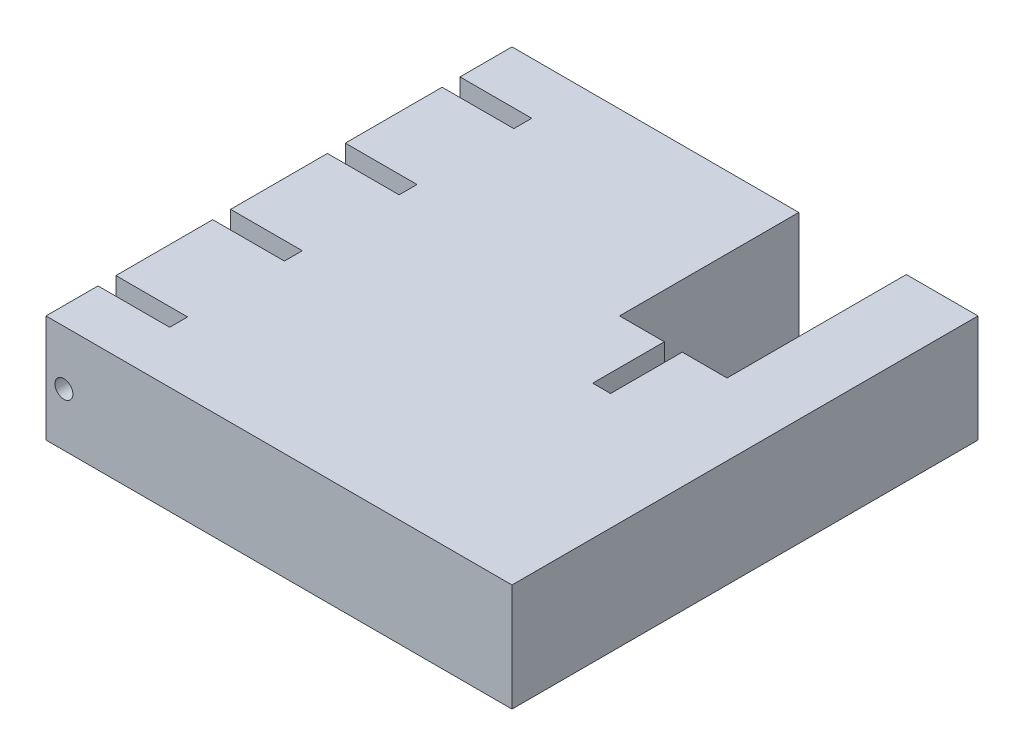
from build123d import *

# Parameters (mm, degrees)
SKETCH2_W               = 130
SKETCH2_H               = 130
BOSS_EXTRUDE1_DEPTH     = 30
CUT_EXTRUDE1_DEPTH      = 163.102342109
CUT_EXTRUDE1_DEPTH_BACK = 163.102342109
SKETCH3_W               = 20
SKETCH3_H               = 5
CUT_EXTRUDE2_DEPTH      = 163.102342109
CUT_EXTRUDE2_DEPTH_BACK = 163.102342109
SKETCH8_W               = 20
SKETCH8_H               = 5
CUT_EXTRUDE3_DEPTH      = 176.12028954
CUT_EXTRUDE3_DEPTH_BACK = 176.12028954
SKETCH9_R               = 2.5
CUT_EXTRUDE4_DEPTH      = 163.102342109
CUT_EXTRUDE4_DEPTH_BACK = 163.102342109
SKETCH10_W              = 30
SKETCH10_H              = 50
CUT_EXTRUDE5_DEPTH      = 163.102342109
CUT_EXTRUDE5_DEPTH_BACK = 163.102342109
SKETCH12_W              = 5
SKETCH12_H              = 20
CUT_EXTRUDE6_DEPTH      = 10
CUT_EXTRUDE6_DEPTH_BACK = 10
SKETCH13_R              = 2.5


with BuildPart() as part:
    # Sketch2 → Boss-Extrude1 (new body)
    with BuildSketch(Plane(origin=(0, 0, 0), x_dir=(1, 0, 0), z_dir=(0, 1, 0))):
        with Locations((-48.433309961, -46.848350496)):
            Rectangle(SKETCH2_W, SKETCH2_H)
    extrude(amount=BOSS_EXTRUDE1_DEPTH)

    # Sketch3 → Cut-Extrude1 (cut, two sides: drawn at the far end of the back side and taken through both)
    with BuildSketch(Plane(origin=(0, 30, 0), x_dir=(1, 0, 0), z_dir=(0, 1, 0)).offset(-CUT_EXTRUDE1_DEPTH_BACK)):
        with Locations((-103.433309961, 1.151649504)):
            Rectangle(SKETCH3_W, SKETCH3_H)
    extrude(amount=CUT_EXTRUDE1_DEPTH + CUT_EXTRUDE1_DEPTH_BACK, mode=Mode.SUBTRACT)

    # Sketch8 → Cut-Extrude2 (cut, two sides: drawn at the far end of the back side and taken through both)
    with BuildSketch(Plane(origin=(0, 30, 0), x_dir=(1, 0, 0), z_dir=(0, 1, 0)).offset(-CUT_EXTRUDE2_DEPTH_BACK)):
        with Locations((-103.433309961, -30.848350496)):
            Rectangle(SKETCH8_W, SKETCH8_H)
        with Locations((-103.433309961, -62.848350496)):
            Rectangle(SKETCH8_W, SKETCH8_H)
        with Locations((-103.433309961, -94.848350496)):
            Rectangle(SKETCH8_W, SKETCH8_H)
    extrude(amount=CUT_EXTRUDE2_DEPTH + CUT_EXTRUDE2_DEPTH_BACK, mode=Mode.SUBTRACT)

    # Sketch9 → Cut-Extrude3 (cut, two sides: drawn at the far end of the back side and taken through both)
    with BuildSketch(Plane.XY.offset(111.848350496).offset(-CUT_EXTRUDE3_DEPTH_BACK)):
        with Locations((-108.433309961, 14.846459041)):
            Circle(SKETCH9_R)
    extrude(amount=CUT_EXTRUDE3_DEPTH + CUT_EXTRUDE3_DEPTH_BACK, mode=Mode.SUBTRACT)

    # Sketch10 → Cut-Extrude4 (cut, two sides: drawn at the far end of the back side and taken through both)
    with BuildSketch(Plane(origin=(0, 30, 0), x_dir=(1, 0, 0), z_dir=(0, 1, 0)).offset(-CUT_EXTRUDE4_DEPTH_BACK)):
        with Locations((-18.433309961, -6.848350496)):
            Rectangle(SKETCH10_W, SKETCH10_H)
    extrude(amount=CUT_EXTRUDE4_DEPTH + CUT_EXTRUDE4_DEPTH_BACK, mode=Mode.SUBTRACT)

    # Sketch12 → Cut-Extrude5 (cut, two sides: drawn at the far end of the back side and taken through both)
    with BuildSketch(Plane(origin=(0, 30, 0), x_dir=(1, 0, 0), z_dir=(0, 1, 0)).offset(-CUT_EXTRUDE5_DEPTH_BACK)):
        with Locations((-18.433309961, -41.848350496)):
            Rectangle(SKETCH12_W, SKETCH12_H)
    extrude(amount=CUT_EXTRUDE5_DEPTH + CUT_EXTRUDE5_DEPTH_BACK, mode=Mode.SUBTRACT)

    # Sketch13 → Cut-Extrude6 (cut, two sides: drawn at the far end of the back side and taken through both)
    with BuildSketch(Plane(origin=(-20.933309961, 0, 0), x_dir=(0, 0, -1), z_dir=(1, 0, 0)).offset(-CUT_EXTRUDE6_DEPTH_BACK)):
        with Locations(Location((-46.848350496, 12.77430984, 0), (0, 0, 180))):
            Circle(SKETCH13_R)
    extrude(amount=CUT_EXTRUDE6_DEPTH + CUT_EXTRUDE6_DEPTH_BACK, mode=Mode.SUBTRACT)


solid = part.part
